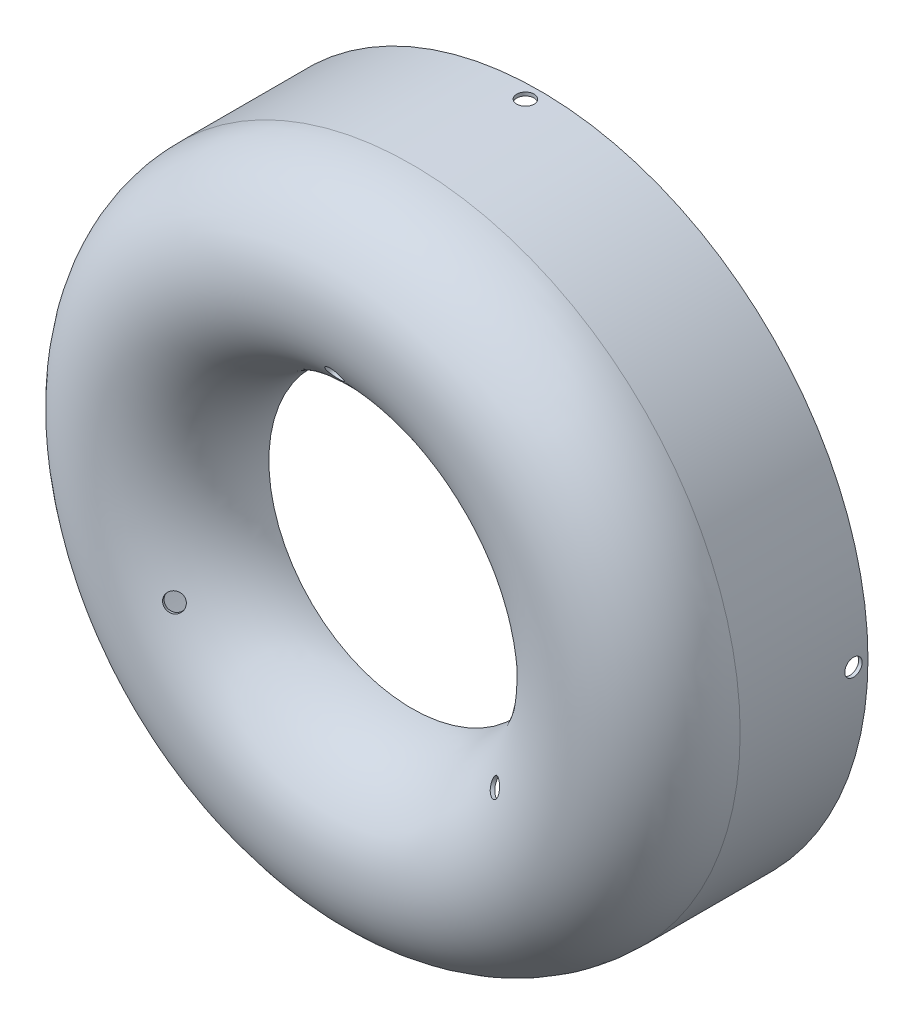
from build123d import *

# Parameters (mm, degrees)
ESQUISSE2_R                  = 1.5
ENL_V_MAT_EXTRU_1_DEPTH      = 89.606546076
R_P_TITION_CIRCULAIRE1_COUNT = 4
ESQUISSE6_R                  = 1.5
ENL_V_MAT_EXTRU_5_DEPTH      = 3
R_P_TITION_CIRCULAIRE4_COUNT = 3


with BuildPart() as part:
    # Esquisse1 → Base-Révolution (revolve)
    with BuildSketch(Plane(origin=(0, 0, 0), x_dir=(0, 0, -1), z_dir=(1, 0, 0)), mode=Mode.PRIVATE) as base_r_volution_sk:
        with BuildLine():
            Line((0, 56.6), (-22.05, 56.6))
            ThreePointArc((-22.05, 56.6), (-38, 40.65), (-22.05, 24.7))
            Line((-22.05, 24.7), (-22.05, 25.3))
            ThreePointArc((-22.05, 25.3), (-37.4, 40.65), (-22.05, 56))
            Line((-22.05, 56), (0, 56))
            Line((0, 56), (0, 56.6))
        make_face()
    revolve(base_r_volution_sk.sketch.rotate(Axis((0, 0, 53.003727506), (0, 0, -1)), 90), axis=Axis((0, 0, 53.003727506), (0, 0, -1)))

    # Esquisse2 → Enlèv. mat.-Extru.1 (cut, through all)
    with BuildSketch(Plane(origin=(0, 0, 0), x_dir=(1, 0, 0), z_dir=(0, 1, 0))):
        with Locations(Location((0, -2.5, 0), (0, 0, 270))):
            Circle(ESQUISSE2_R)
    enl_v_mat_extru_1 = extrude(amount=-ENL_V_MAT_EXTRU_1_DEPTH, mode=Mode.SUBTRACT)

    # Répétition circulaire1: Enlèv. mat.-Extru.1 ×4 about axis
    r_p_tition_circulaire1_axis = Axis((0, 0, 53.003727506), (0, 0, -1))
    for i in range(1, R_P_TITION_CIRCULAIRE1_COUNT):
        add(enl_v_mat_extru_1.rotate(r_p_tition_circulaire1_axis, i * 360 / R_P_TITION_CIRCULAIRE1_COUNT), mode=Mode.SUBTRACT)

    # Esquisse6 → Enlèv. mat.-Extru.5 (cut)
    with BuildSketch(Plane(origin=(0, -7.41473671, 12.842700706), x_dir=(-1, 0, 0), z_dir=(0, 0.49999999999999806, -0.8660254037844397))):
        with Locations(Location((0, 45.356406461, 0), (0, 0, 292.170563159))):
            Circle(ESQUISSE6_R)
    enl_v_mat_extru_5 = extrude(amount=ENL_V_MAT_EXTRU_5_DEPTH, mode=Mode.SUBTRACT)

    # Répétition circulaire4: Enlèv. mat.-Extru.5 ×3 about axis
    r_p_tition_circulaire4_axis = Axis((0, 0, 53.003727506), (0, 0, -1))
    for i in range(1, R_P_TITION_CIRCULAIRE4_COUNT):
        add(enl_v_mat_extru_5.rotate(r_p_tition_circulaire4_axis, i * 360 / R_P_TITION_CIRCULAIRE4_COUNT), mode=Mode.SUBTRACT)


solid = part.part
